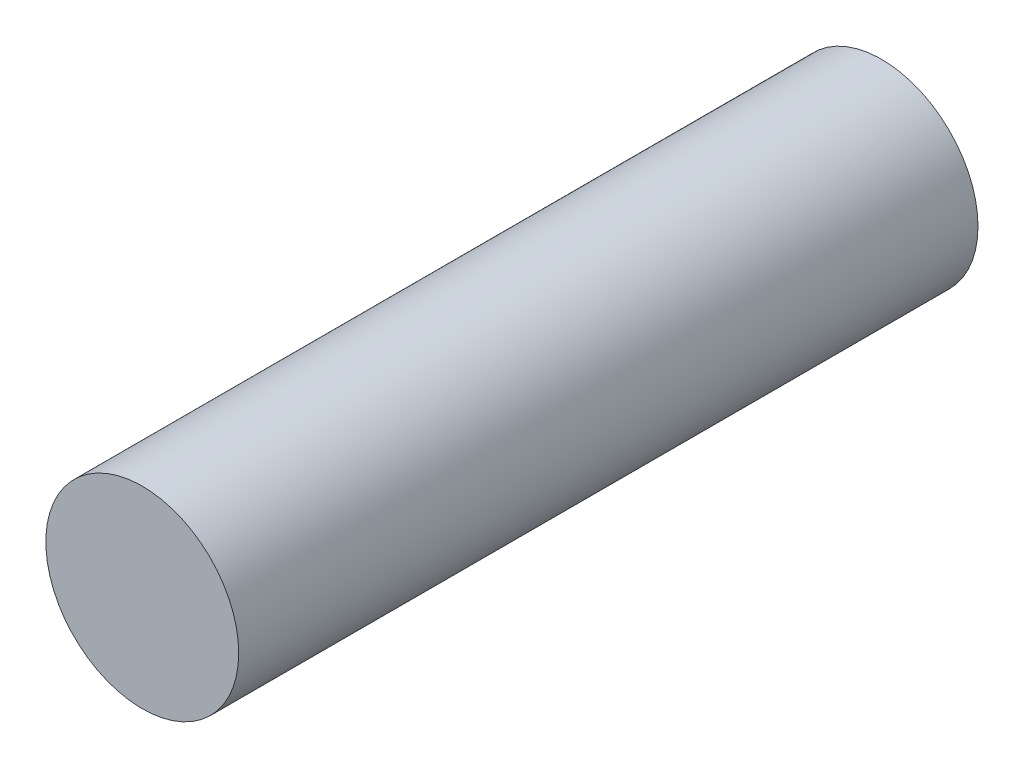
from build123d import *

# Parameters (mm, degrees)
ESQUISSE1_R          = 1.5
BASE_EXTRUSION_DEPTH = 11.5


with BuildPart() as part:
    # Esquisse1 → Base-Extrusion (new body)
    with BuildSketch(Plane.XY):
        Circle(ESQUISSE1_R)
    extrude(amount=BASE_EXTRUSION_DEPTH)


solid = part.part
